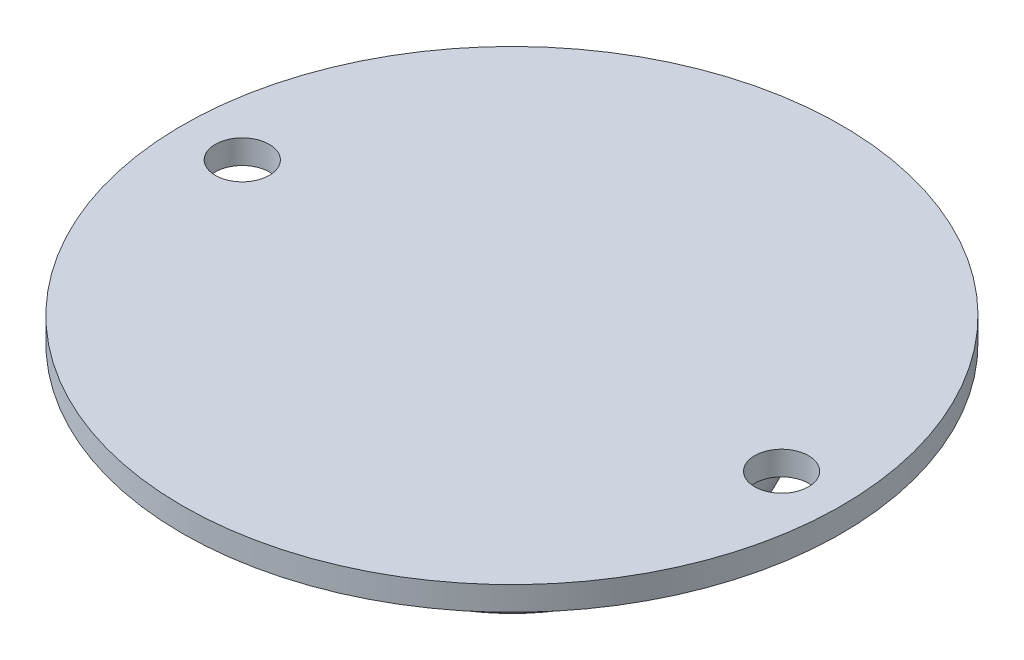
from build123d import *

# Parameters (mm, degrees)
SKETCH1_R           = 17.5
BOSS_EXTRUDE1_DEPTH = 12
SKETCH2_R           = 27.5
BOSS_EXTRUDE2_DEPTH = 2
SKETCH3_W           = 4.5
SKETCH3_H           = 43.807088702
CUT_EXTRUDE2_DEPTH  = 12
FILLET1_R           = 10
SKETCH4_R           = 2.25
CUT_EXTRUDE3_DEPTH  = 101.6


with BuildPart() as part:
    # Sketch1 → Boss-Extrude1 (new body)
    with BuildSketch(Plane(origin=(0, 0, 0), x_dir=(1, 0, 0), z_dir=(0, 1, 0))):
        with Locations(Location((0, 0, 0), (0, 0, 270))):
            Circle(SKETCH1_R)
    extrude(amount=BOSS_EXTRUDE1_DEPTH)

    # Sketch2 → Boss-Extrude2 (add)
    with BuildSketch(Plane(origin=(0, 12, 0), x_dir=(1, 0, 0), z_dir=(0, 1, 0))):
        with Locations(Location((0, 0, 0), (0, 0, 270))):
            Circle(SKETCH2_R)
    extrude(amount=BOSS_EXTRUDE2_DEPTH)

    # Sketch3 → Cut-Extrude2 (cut)
    with BuildSketch(Plane(origin=(0, 0, 0), x_dir=(-1, 0, 0), z_dir=(0, -1, 0))):
        Rectangle(SKETCH3_W, SKETCH3_H)
    extrude(amount=-CUT_EXTRUDE2_DEPTH, mode=Mode.SUBTRACT)

    # Fillet1
    fillet1_edges = [part.edges().sort_by_distance(p)[0] for p in [
        (-17.5, 0, 0),
        (17.5, 0, 0),
    ]]
    fillet(fillet1_edges, radius=FILLET1_R)

    # Sketch4 → Cut-Extrude3 (cut)
    with BuildSketch(Plane(origin=(0, 12, 0), x_dir=(-1, 0, 0), z_dir=(0, -1, 0))):
        with Locations(Location((-22.5, 0, 0), (0, 0, 90))):
            Circle(SKETCH4_R)
        with Locations(Location((22.5, 0, 0), (0, 0, 90))):
            Circle(SKETCH4_R)
    extrude(amount=-CUT_EXTRUDE3_DEPTH, mode=Mode.SUBTRACT)


solid = part.part
